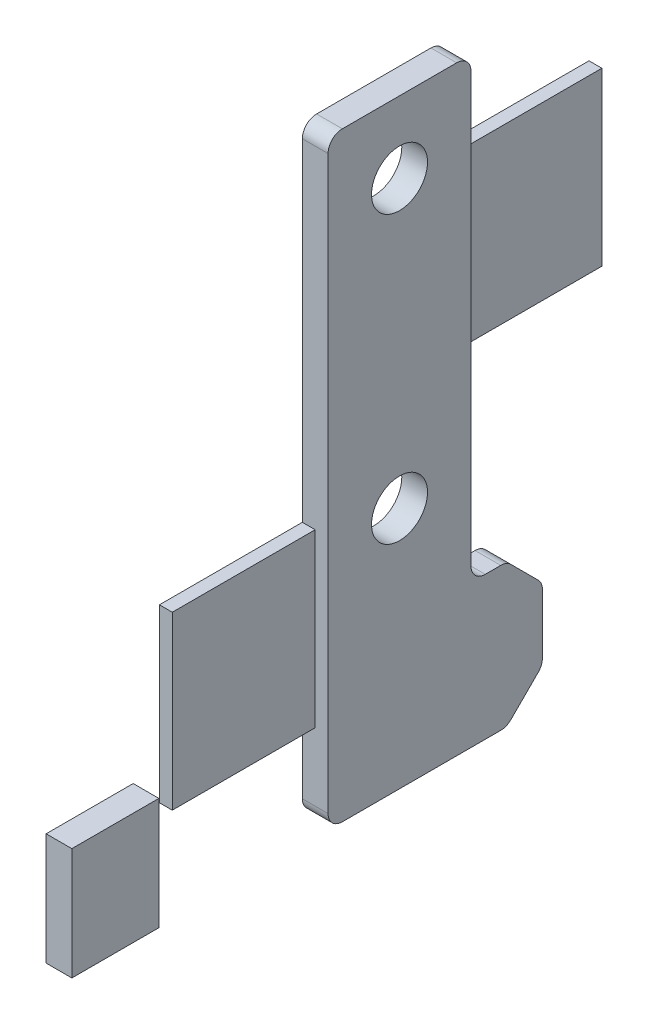
from build123d import *

# Parameters (mm, degrees)
SKETCH1_R           = 2.4892
BOSS_EXTRUDE1_DEPTH = 2.286
CHAMFER1_SIZE       = 3.175
FILLET2_R           = 1.27
SKETCH3_W           = 7.735009394
SKETCH3_H           = 9.957239347
BOSS_EXTRUDE2_DEPTH = 2.286
SKETCH5_W           = 12.7
SKETCH5_H           = 15.24
SKETCH5_W_2         = 12.777654753
BOSS_EXTRUDE3_DEPTH = 1.143


with BuildPart() as part:
    # Sketch1 → Boss-Extrude1 (new body)
    with BuildSketch(Plane(origin=(0, 0, -8.688049905), x_dir=(0, 0, -1), z_dir=(1, 0, 0))):
        Polygon((0, 0), (0, 53.34), (12.7, 53.34), (12.7, 12.7), (19.05, 12.7), (19.05, 0), align=None)
        with Locations((6.35, 46.99)):
            Circle(SKETCH1_R, mode=Mode.SUBTRACT)
        with Locations((6.35, 21.59)):
            Circle(SKETCH1_R, mode=Mode.SUBTRACT)
    extrude(amount=BOSS_EXTRUDE1_DEPTH)

    # Chamfer1
    chamfer1_edges = [part.edges().sort_by_distance(p)[0] for p in [
        (1.143, 12.7, -27.738049905),
        (1.143, 0, -27.738049905),
    ]]
    chamfer(chamfer1_edges, length=CHAMFER1_SIZE)

    # Fillet2
    fillet2_edges = [part.edges().sort_by_distance(p)[0] for p in [
        (1.143, 0, -8.688049905),
        (1.143, 53.34, -8.688049905),
        (1.143, 53.34, -21.388049905),
        (1.143, 12.7, -21.388049905),
        (1.143, 9.525, -27.738049905),
        (1.143, 3.175, -27.738049905),
        (1.143, 0, -24.563049905),
        (1.143, 12.7, -24.563049905),
    ]]
    fillet(fillet2_edges, radius=FILLET2_R)

    # Sketch5 → Boss-Extrude3 (add)
    with BuildSketch(Plane.ZY):
        with Locations((-2.338049905, 14.926432306)):
            Rectangle(SKETCH5_W, SKETCH5_H)
        with Locations((-27.776877282, 37.707148949)):
            Rectangle(SKETCH5_W_2, SKETCH5_H)
    extrude(amount=-BOSS_EXTRUDE3_DEPTH)


with BuildPart() as body_2:
    # Sketch3 → Boss-Extrude2 (new body)
    with BuildSketch(Plane.ZY):
        with Locations((10.2128886, 4.978619673)):
            Rectangle(SKETCH3_W, SKETCH3_H)
    extrude(amount=-BOSS_EXTRUDE2_DEPTH)


solid = Compound([part.part, body_2.part])
